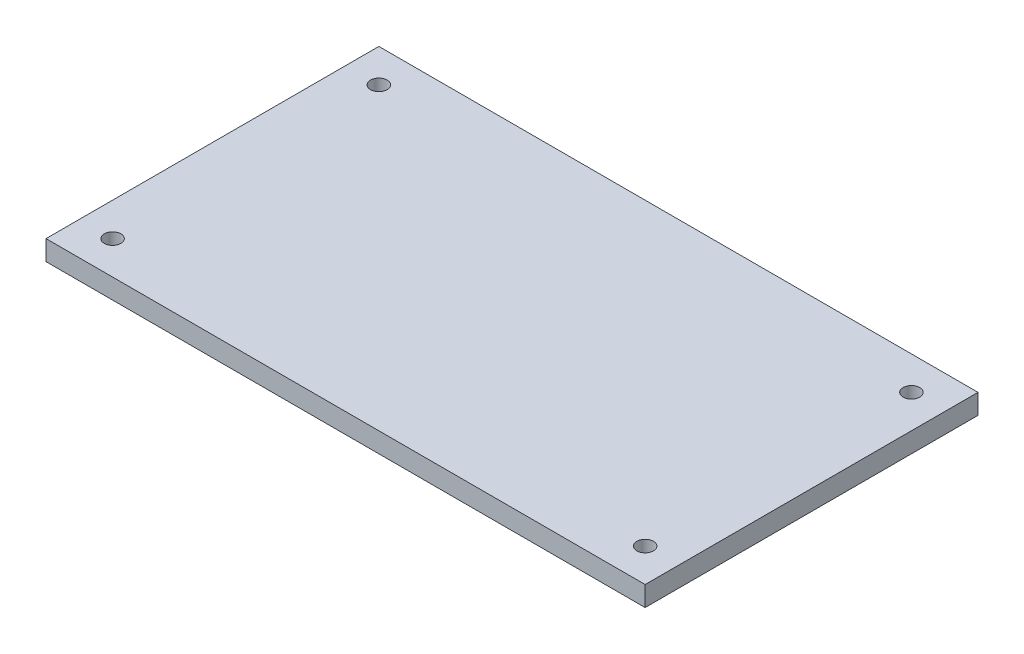
from build123d import *

# Parameters (mm, degrees)
SKETCH_1_W          = 90
SKETCH_1_H          = 50
EXTRUDE_1_DEPTH     = 3
SKETCH_2_R          = 1.25
CUT_EXTRUDE_1_DEPTH = 3


with BuildPart() as part:
    # Эскиз1 → Бобышка-Вытянуть1 (new body)
    with BuildSketch(Plane(origin=(0, 0, 0), x_dir=(1, 0, 0), z_dir=(0, 1, 0))):
        with Locations((33.879310345, 5.280172414)):
            Rectangle(SKETCH_1_W, SKETCH_1_H)
    extrude(amount=EXTRUDE_1_DEPTH)

    # Эскиз2 → Вырез-Вытянуть1 (cut)
    with BuildSketch(Plane(origin=(0, 3, 0), x_dir=(1, 0, 0), z_dir=(0, 1, 0))):
        with Locations(Location((-6.120689655, 25.280172414, 0), (0, 0, 270))):
            Circle(SKETCH_2_R)
        with Locations(Location((73.879310345, 25.280172414, 0), (0, 0, 270))):
            Circle(SKETCH_2_R)
        with Locations(Location((73.879310345, -14.719827586, 0), (0, 0, 270))):
            Circle(SKETCH_2_R)
        with Locations(Location((-6.120689655, -14.719827586, 0), (0, 0, 270))):
            Circle(SKETCH_2_R)
    extrude(amount=-CUT_EXTRUDE_1_DEPTH, mode=Mode.SUBTRACT)


solid = part.part
